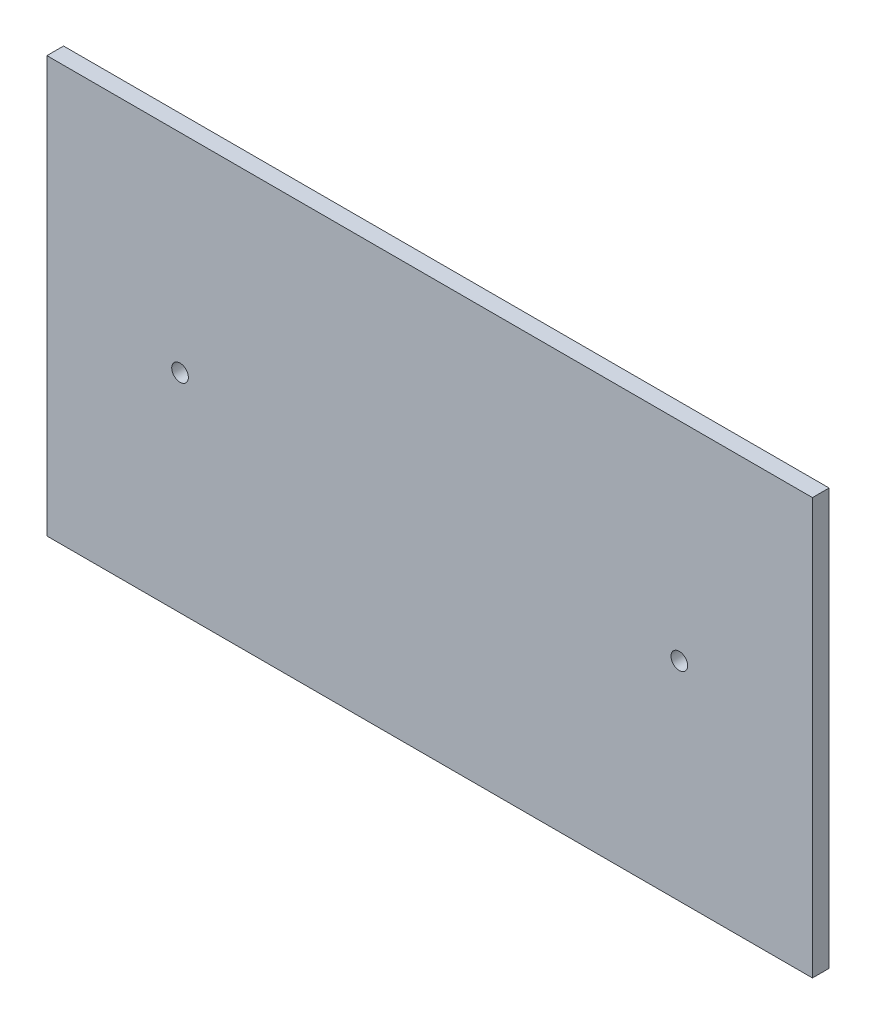
from build123d import *

# Parameters (mm, degrees)
SKIZZE1_W                       = 460
SKIZZE1_H                       = 250
SKIZZE1_R                       = 5
AUFSATZ_LINEAR_AUSTRAGEN1_DEPTH = 10


with BuildPart() as part:
    # Skizze1 → Aufsatz-Linear austragen1 (new body)
    with BuildSketch(Plane.XY):
        Rectangle(SKIZZE1_W, SKIZZE1_H)
        with Locations((-150, 0)):
            Circle(SKIZZE1_R, mode=Mode.SUBTRACT)
        with Locations((150, 0)):
            Circle(SKIZZE1_R, mode=Mode.SUBTRACT)
    extrude(amount=AUFSATZ_LINEAR_AUSTRAGEN1_DEPTH)


solid = part.part
